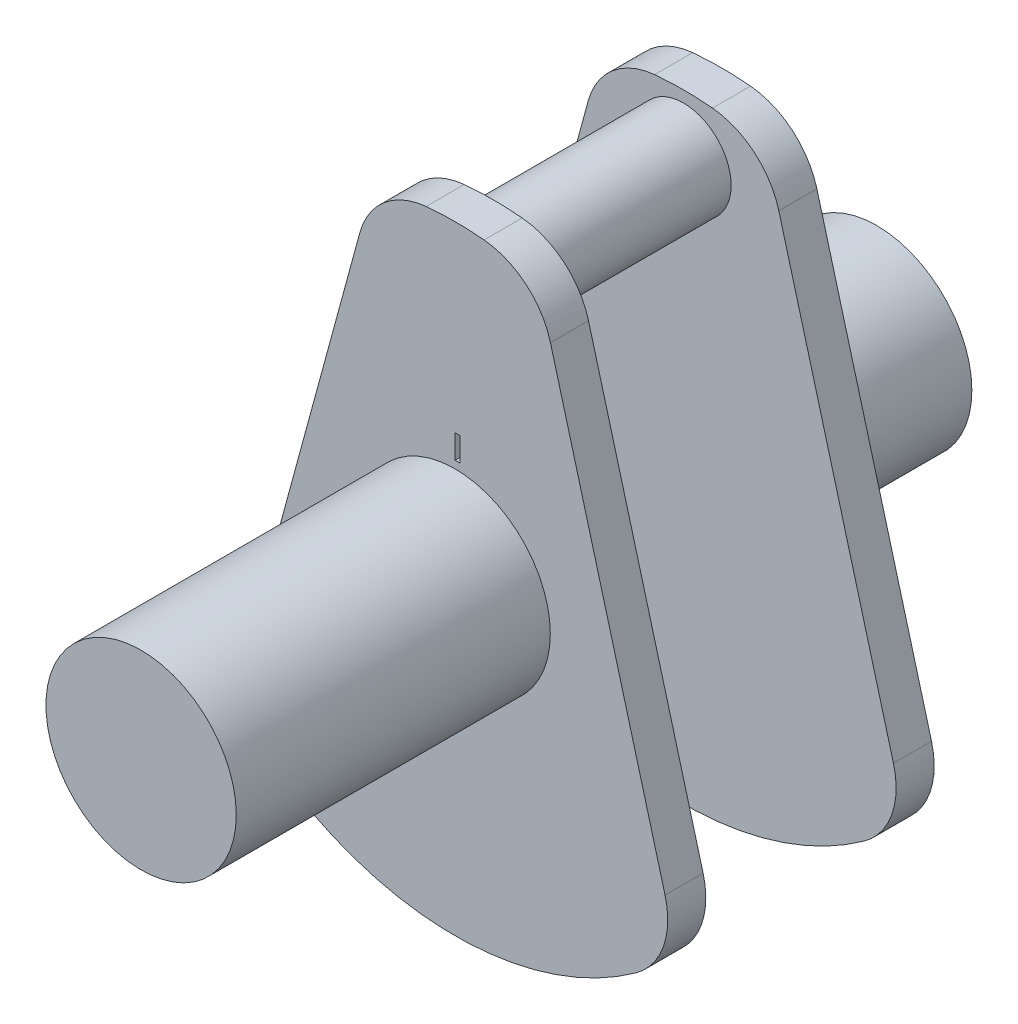
from build123d import *

# Parameters (mm, degrees)
BOSS_EXTRUDE1_DEPTH = 20.32
SKETCH2_R           = 25.4
BOSS_EXTRUDE2_DEPTH = 50.8
SKETCH4_R           = 50.8
BOSS_EXTRUDE3_DEPTH = 82.804
SKETCH5_R           = 50.8
BOSS_EXTRUDE4_DEPTH = 84.836
SKETCH6_W           = 2.54
SKETCH6_H           = 12.7
CUT_EXTRUDE1_DEPTH  = 2.54


with BuildPart() as part:
    # Sketch1 → Boss-Extrude1 (new body)
    with BuildSketch(Plane.XY):
        with BuildLine():
            Line((-50.872217321, 134.585225504), (-112.061443675, -90.240779366))
            ThreePointArc((-112.061443675, -90.240779366), (-111.162689162, -114.462461255), (-96.634871694, -133.864526939))
            ThreePointArc((-96.634871694, -133.864526939), (0, -165.1), (96.634871694, -133.864526939))
            ThreePointArc((96.634871694, -133.864526939), (111.162689162, -114.462461255), (112.061443675, -90.240779366))
            Line((112.061443675, -90.240779366), (50.872217321, 134.585225504))
            ThreePointArc((50.872217321, 134.585225504), (37.822210961, 155.010576595), (15.465489796, 164.374050949))
            ThreePointArc((15.465489796, 164.374050949), (0, 165.1), (-15.465489796, 164.374050949))
            ThreePointArc((-15.465489796, 164.374050949), (-37.822210961, 155.010576595), (-50.872217321, 134.585225504))
        make_face()
    extrude(amount=BOSS_EXTRUDE1_DEPTH)

    # Sketch2 → Boss-Extrude2 (add)
    with BuildSketch(Plane.XY.offset(20.32)):
        with Locations((0, 133.5786)):
            Circle(SKETCH2_R)
    extrude(amount=BOSS_EXTRUDE2_DEPTH)

    # Sketch4 → Boss-Extrude3 (add)
    with BuildSketch(Plane(origin=(0, 0, 0), x_dir=(-1, 0, 0), z_dir=(0, 0, -1))):
        with Locations(Location((0, 0, 0), (0, 0, 180))):
            Circle(SKETCH4_R)
    extrude(amount=BOSS_EXTRUDE3_DEPTH)

    # Mirror1: part across plane


with BuildPart() as part_1:
    add(part.part)
    add(part.part.mirror(Plane(origin=(0, 133.5786, 71.12), x_dir=(1, 0, 0), z_dir=(0, 0, 1))))

    # Sketch5 → Boss-Extrude4 (add)
    with BuildSketch(Plane.XY.offset(225.044)):
        Circle(SKETCH5_R)
    extrude(amount=BOSS_EXTRUDE4_DEPTH)

    # Sketch6 → Cut-Extrude1 (cut)
    with BuildSketch(Plane.XY.offset(142.24)):
        with Locations((1.27, 61.148656496)):
            Rectangle(SKETCH6_W, SKETCH6_H)
    extrude(amount=-CUT_EXTRUDE1_DEPTH, mode=Mode.SUBTRACT)


solid = part_1.part
